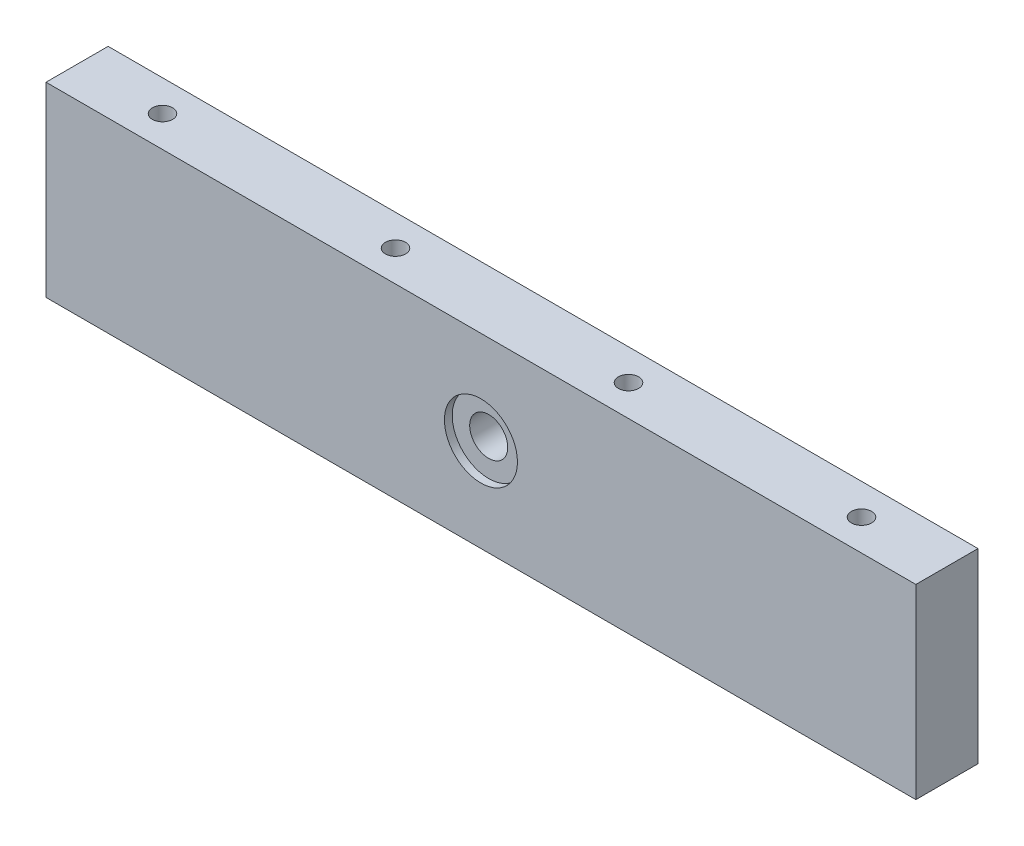
from build123d import *

# Parameters (mm, degrees)
SKETCH_1_W          = 112
SKETCH_1_H          = 24
EXTRUDE_1_DEPTH     = 8
SKETCH_2_R          = 1.3
CUT_EXTRUDE_1_DEPTH = 30
SKETCH_3_R          = 2.45
CUT_EXTRUDE_2_DEPTH = 30
CUT_EXTRUDE_3_DEPTH = 2
SKETCH_5_R          = 4.7
CUT_EXTRUDE_4_DEPTH = 1


with BuildPart() as part:
    # 草图1 → 凸台-拉伸1 (new body)
    with BuildSketch(Plane.XY):
        Rectangle(SKETCH_1_W, SKETCH_1_H)
    extrude(amount=EXTRUDE_1_DEPTH)

    # 草图2 → 切除-拉伸1 (cut)
    with BuildSketch(Plane(origin=(0, 12, 0), x_dir=(1, 0, 0), z_dir=(0, 1, 0))):
        with Locations(Location((-15, -4, 0), (0, 0, 270))):
            Circle(SKETCH_2_R)
        with Locations(Location((-45, -4, 0), (0, 0, 270))):
            Circle(SKETCH_2_R)
        with Locations(Location((45, -4, 0), (0, 0, 270))):
            Circle(SKETCH_2_R)
        with Locations(Location((15, -4, 0), (0, 0, 270))):
            Circle(SKETCH_2_R)
    extrude(amount=-CUT_EXTRUDE_1_DEPTH, mode=Mode.SUBTRACT)

    # 草图3 → 切除-拉伸2 (cut)
    with BuildSketch(Plane(origin=(0, 0, 0), x_dir=(-1, 0, 0), z_dir=(0, 0, -1))):
        Circle(SKETCH_3_R)
    extrude(amount=-CUT_EXTRUDE_2_DEPTH, mode=Mode.SUBTRACT)

    # 草图4 → 切除-拉伸3 (cut)
    with BuildSketch(Plane(origin=(0, 0, 0), x_dir=(-1, 0, 0), z_dir=(0, 0, -1))):
        Polygon((4.052179536, -1.964647808), (3.727524679, 2.526966514), (-0.324654856, 4.491614323), (-4.052179536, 1.964647808), (-3.727524679, -2.526966514), (0.324654856, -4.491614323), align=None)
    extrude(amount=-CUT_EXTRUDE_3_DEPTH, mode=Mode.SUBTRACT)

    # 草图5 → 切除-拉伸4 (cut)
    with BuildSketch(Plane.XY.offset(8)):
        Circle(SKETCH_5_R)
    extrude(amount=-CUT_EXTRUDE_4_DEPTH, mode=Mode.SUBTRACT)


solid = part.part
